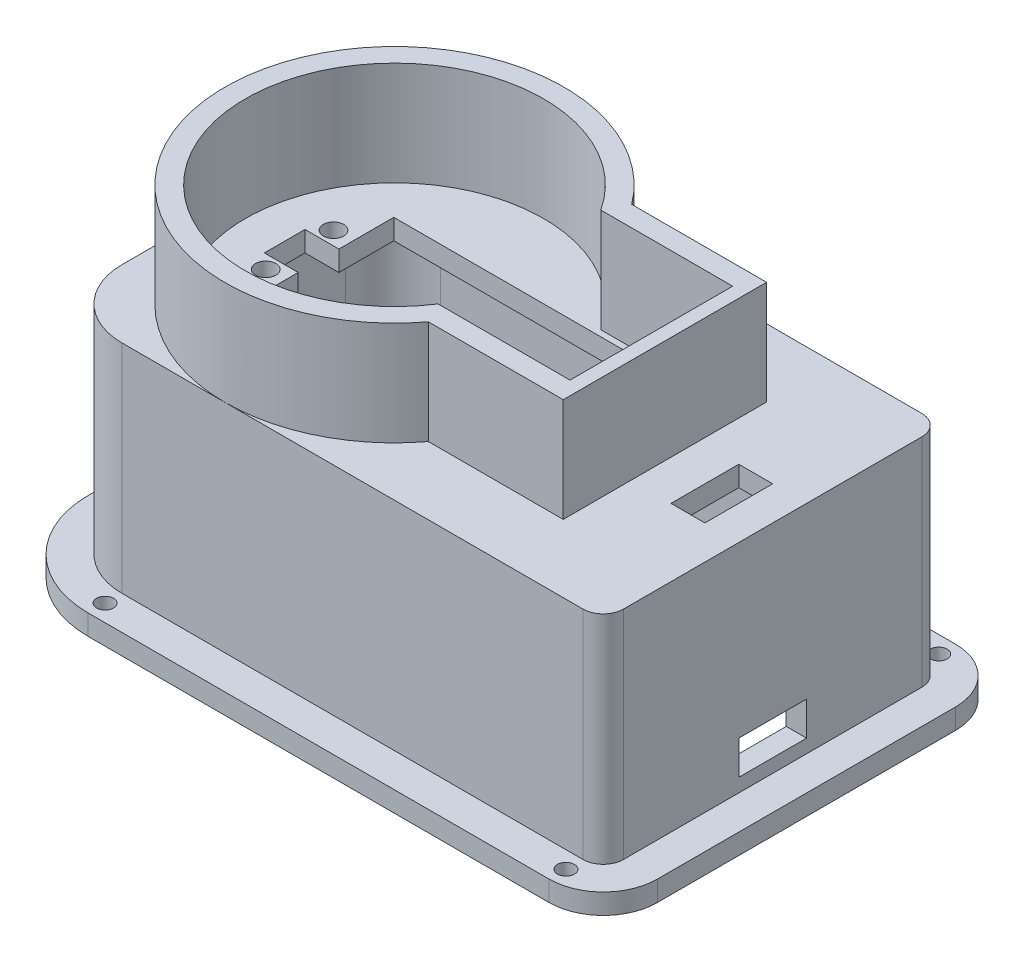
from build123d import *

# Parameters (mm, degrees)
SKETCH1_W           = 81
SKETCH1_H           = 50
SKETCH1_R           = 1.5
BOSS_EXTRUDE1_DEPTH = 35
FILLET1_R           = 10
FILLET2_R           = 3
CUT_EXTRUDE1_DEPTH  = 32
BOSS_EXTRUDE2_DEPTH = 15.3
SKETCH4_W           = 1
SKETCH4_H           = 24
CUT_EXTRUDE2_DEPTH  = 15.3
SKETCH5_W           = 10
SKETCH5_H           = 5
CUT_EXTRUDE3_DEPTH  = 16.3
SKETCH6_R           = 1.25
BOSS_EXTRUDE3_DEPTH = 3
SKETCH7_W           = 5
SKETCH7_H           = 10
CUT_EXTRUDE4_DEPTH  = 10


with BuildPart() as part:
    # Sketch1 → Boss-Extrude1 (new body)
    with BuildSketch(Plane(origin=(0, 0, 0), x_dir=(1, 0, 0), z_dir=(0, 1, 0))):
        with Locations((5.4, 0)):
            Rectangle(SKETCH1_W, SKETCH1_H)
        with Locations(Location((-23.9, 5, 0), (0, 0, 270))):
            Circle(SKETCH1_R, mode=Mode.SUBTRACT)
        with Locations(Location((-23.9, -5, 0), (0, 0, 90))):
            Circle(SKETCH1_R, mode=Mode.SUBTRACT)
        with Locations(Location((24.1, 5, 0), (0, 0, 90))):
            Circle(SKETCH1_R, mode=Mode.SUBTRACT)
        with Locations(Location((24.1, -5, 0), (0, 0, 270))):
            Circle(SKETCH1_R, mode=Mode.SUBTRACT)
        Polygon((-21.1, 3), (-26.1, 3), (-26.1, -3), (-21.1, -3), (-21.1, -11.1), (21.1, -11.1), (21.1, 11.1), (-21.1, 11.1), align=None, mode=Mode.SUBTRACT)
    extrude(amount=-BOSS_EXTRUDE1_DEPTH)

    # Fillet1
    fillet1_edges = [part.edges().sort_by_distance(p)[0] for p in [
        (-35.1, -17.5, 25),
        (-35.1, -17.5, -25),
    ]]
    fillet(fillet1_edges, radius=FILLET1_R)

    # Fillet2
    fillet2_edges = [part.edges().sort_by_distance(p)[0] for p in [
        (45.9, -17.5, 25),
        (45.9, -17.5, -25),
    ]]
    fillet(fillet2_edges, radius=FILLET2_R)

    # Sketch3 → Cut-Extrude1 (cut)
    with BuildSketch(Plane.XZ.offset(35)):
        with BuildLine():
            Line((42.9, 22), (-25.1, 22))
            ThreePointArc((-25.1, 22), (-30.049747468, 19.949747468), (-32.1, 15))
            Line((-32.1, 15), (-32.1, -15))
            ThreePointArc((-32.1, -15), (-30.049747468, -19.949747468), (-25.1, -22))
            Line((-25.1, -22), (42.9, -22))
            Line((42.9, -22), (42.9, 22))
        make_face()
    extrude(amount=-CUT_EXTRUDE1_DEPTH, mode=Mode.SUBTRACT)

    # Sketch2 → Boss-Extrude2 (add)
    with BuildSketch(Plane(origin=(0, 0, 0), x_dir=(1, 0, 0), z_dir=(0, 1, 0))):
        with BuildLine():
            Line((10.1, 15), (30, 15))
            Line((30, 15), (30, -15))
            Line((30, -15), (10.1, -15))
            ThreePointArc((10.1, -15), (-34.9, 0), (10.1, 15))
        make_face()
        with BuildLine():
            Line((8.539088915, 12), (27, 12))
            Line((27, 12), (27, -12))
            Line((27, -12), (8.539088915, -12))
            ThreePointArc((8.539088915, -12), (-31.9, 0), (8.539088915, 12))
        make_face(mode=Mode.SUBTRACT)
    extrude(amount=BOSS_EXTRUDE2_DEPTH)

    # Sketch4 → Cut-Extrude2 (cut)
    with BuildSketch(Plane(origin=(0, 15.3, 0), x_dir=(1, 0, 0), z_dir=(0, 1, 0))):
        with Locations((27.5, 0)):
            Rectangle(SKETCH4_W, SKETCH4_H)
    extrude(amount=-CUT_EXTRUDE2_DEPTH, mode=Mode.SUBTRACT)

    # Sketch5 → Cut-Extrude3 (cut)
    with BuildSketch(Plane(origin=(45.9, 0, 0), x_dir=(0, 0, -1), z_dir=(1, 0, 0))):
        with Locations((0, -27.5)):
            Rectangle(SKETCH5_W, SKETCH5_H)
    extrude(amount=-CUT_EXTRUDE3_DEPTH, mode=Mode.SUBTRACT)

    # Sketch6 → Boss-Extrude3 (add)
    with BuildSketch(Plane.XZ.offset(35)):
        with BuildLine():
            Line((42.9, 30), (-25.1, 30))
            ThreePointArc((-25.1, 30), (-35.706601718, 25.606601718), (-40.1, 15))
            Line((-40.1, 15), (-40.1, -15))
            ThreePointArc((-40.1, -15), (-35.706601718, -25.606601718), (-25.1, -30))
            Line((-25.1, -30), (42.9, -30))
            ThreePointArc((42.9, -30), (48.556854249, -27.656854249), (50.9, -22))
            Line((50.9, -22), (50.9, 22))
            ThreePointArc((50.9, 22), (48.556854249, 27.656854249), (42.9, 30))
        make_face()
        with Locations(Location((-25.1, 27.5, 0), (0, 0, 270))):
            Circle(SKETCH6_R, mode=Mode.SUBTRACT)
        with Locations(Location((42.9, 27.5, 0), (0, 0, 270))):
            Circle(SKETCH6_R, mode=Mode.SUBTRACT)
        with Locations(Location((42.9, -27.5, 0), (0, 0, 270))):
            Circle(SKETCH6_R, mode=Mode.SUBTRACT)
        with Locations(Location((-25.1, -27.5, 0), (0, 0, 270))):
            Circle(SKETCH6_R, mode=Mode.SUBTRACT)
        with BuildLine():
            Line((45.9, -22), (45.9, 22))
            ThreePointArc((45.9, 22), (45.021320344, 24.121320344), (42.9, 25))
            Line((42.9, 25), (-25.1, 25))
            ThreePointArc((-25.1, 25), (-32.171067812, 22.071067812), (-35.1, 15))
            Line((-35.1, 15), (-35.1, -15))
            ThreePointArc((-35.1, -15), (-32.171067812, -22.071067812), (-25.1, -25))
            Line((-25.1, -25), (42.9, -25))
            ThreePointArc((42.9, -25), (45.021320344, -24.121320344), (45.9, -22))
        make_face(mode=Mode.SUBTRACT)
    extrude(amount=-BOSS_EXTRUDE3_DEPTH)

    # Sketch7 → Cut-Extrude4 (cut)
    with BuildSketch(Plane(origin=(0, 0, 0), x_dir=(1, 0, 0), z_dir=(0, 1, 0))):
        with Locations((38.4, 0)):
            Rectangle(SKETCH7_W, SKETCH7_H)
    extrude(amount=-CUT_EXTRUDE4_DEPTH, mode=Mode.SUBTRACT)


solid = part.part
